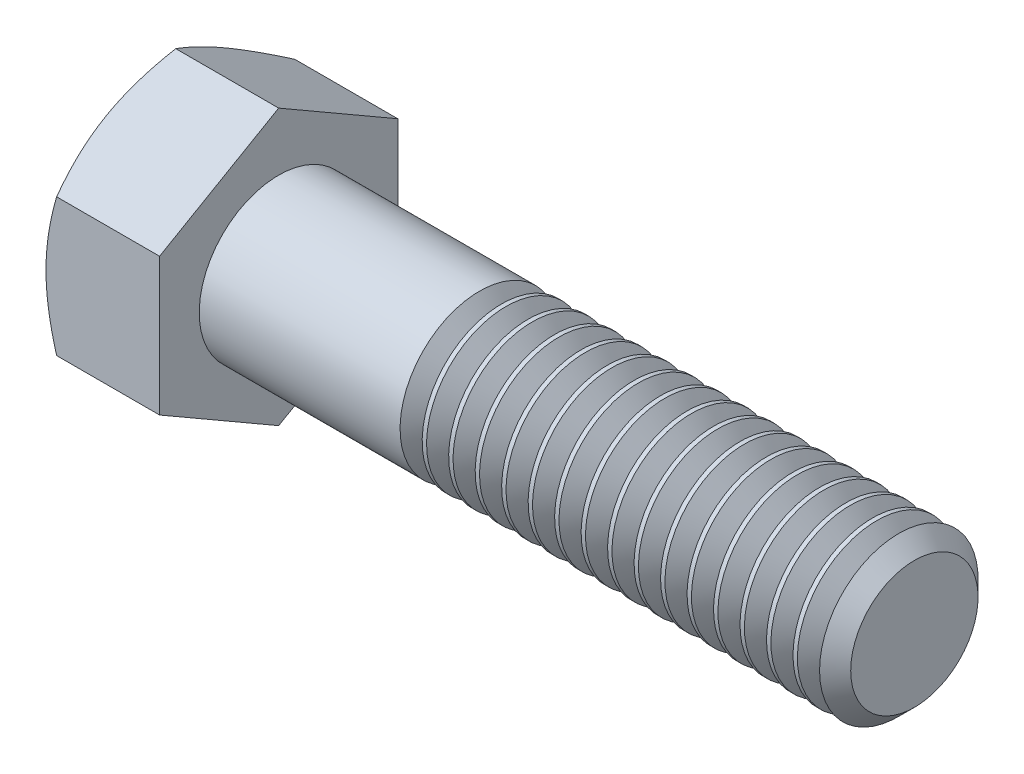
from build123d import *

# Parameters (mm, degrees)
BASEHEAD_DEPTH  = 6.8072
THDSCHPAT_COUNT = 16
THDSCHPAT_PITCH = 1.5875


with BuildPart() as part:
    # Sketch1 → BaseHead (new body)
    with BuildSketch(Plane(origin=(0, 0, 0), x_dir=(0, 0, -1), z_dir=(1, 0, 0))):
        Polygon((7.1374, 4.120779811), (7.1374, -4.120779811), (0, -8.241559623), (-7.1374, -4.120779811), (-7.1374, 4.120779811), (0, 8.241559623), align=None)
    extrude(amount=BASEHEAD_DEPTH)

    # BodySke → BaseBody (revolve)
    with BuildSketch(Plane.XY, mode=Mode.PRIVATE) as basebody_sk:
        Polygon((0, 0), (44.9072, 0), (44.9072, 3.81635), (43.96105, 4.7625), (0, 4.7625), align=None)
    revolve(basebody_sk.sketch.rotate(Axis((0, 0, 0), (1, 0, 0)), 90), axis=Axis((0, 0, 0), (1, 0, 0)))

    # Sketch3 → HeadChamfer (revolve, cut)
    with BuildSketch(Plane.XY):
        Polygon((0, 7.1374), (4.303661065, 14.591559623), (4.303661065, 20.941559623), (-12.7, 20.941559623), (-12.7, 7.1374), align=None)
    revolve(axis=Axis((0, 0, 0), (1, 0, 0)), mode=Mode.SUBTRACT)

    # ThdSchSke → ThreadSchematic (revolve, cut)
    with BuildSketch(Plane.XY):
        Polygon((19.5072, -3.81635), (18.844698638, -4.7625), (18.844698638, -5.953125), (20.169701362, -5.953125), (20.169701362, -4.7625), align=None)
    threadschematic = revolve(axis=Axis((-3.175, 0, 0), (1, 0, 0)), mode=Mode.SUBTRACT)

    # ThdSchPat: ThreadSchematic ×16
    with Locations(*[(i * THDSCHPAT_PITCH, 0, 0) for i in range(1, THDSCHPAT_COUNT)]):
        add(threadschematic, mode=Mode.SUBTRACT)


solid = part.part
